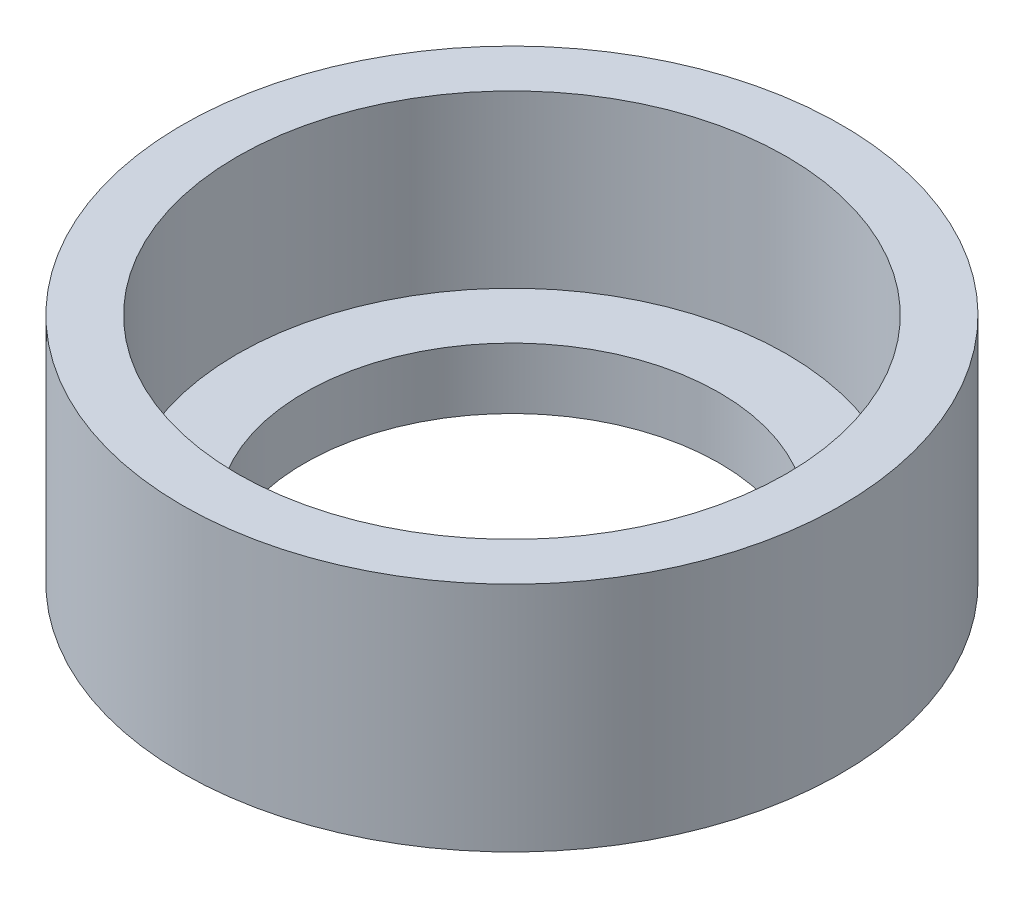
from build123d import *

# Parameters (mm, degrees)
SKETCH1_R           = 13.5
SKETCH1_R_2         = 8.5
BOSS_EXTRUDE1_DEPTH = 9.5
SKETCH2_R           = 11.25
CUT_EXTRUDE1_DEPTH  = 7


with BuildPart() as part:
    # Sketch1 → Boss-Extrude1 (new body)
    with BuildSketch(Plane(origin=(0, 0, 0), x_dir=(1, 0, 0), z_dir=(0, 1, 0))):
        with Locations(Location((0, 0, 0), (0, 0, 270))):
            Circle(SKETCH1_R)
        with Locations(Location((0, 0, 0), (0, 0, 270))):
            Circle(SKETCH1_R_2, mode=Mode.SUBTRACT)
    extrude(amount=BOSS_EXTRUDE1_DEPTH)

    # Sketch2 → Cut-Extrude1 (cut)
    with BuildSketch(Plane(origin=(0, 9.5, 0), x_dir=(-1, 0, 0), z_dir=(0, 1, 0))):
        with Locations(Location((0, 0, 0), (0, 0, 90))):
            Circle(SKETCH2_R)
    extrude(amount=-CUT_EXTRUDE1_DEPTH, mode=Mode.SUBTRACT)


solid = part.part
